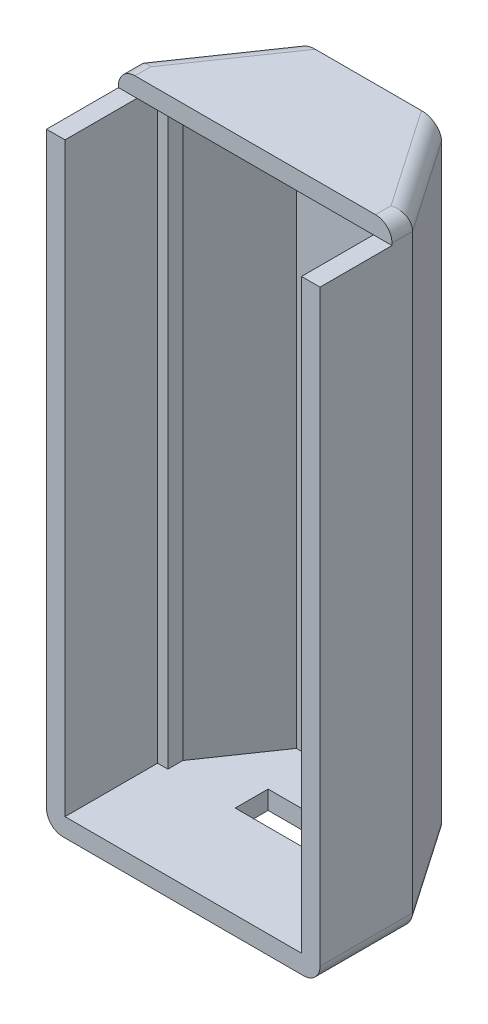
from build123d import *

# Parameters (mm, degrees)
BOSS_EXTRUDE1_DEPTH = 57
SKETCH4_W           = 6.5
SKETCH4_H           = 8.5
CUT_EXTRUDE1_DEPTH  = 62.236345417
BOSS_EXTRUDE2_DEPTH = 1.8
SKETCH5_W           = 7.9
SKETCH5_H           = 3.2
CUT_EXTRUDE2_DEPTH  = 63.91526047
BOSS_EXTRUDE3_DEPTH = 1.8
FILLET1_R           = 1.6


with BuildPart() as part:
    # Sketch1 → Boss-Extrude1 (new body)
    with BuildSketch(Plane(origin=(0, 0, 0), x_dir=(1, 0, 0), z_dir=(0, 1, 0))):
        Polygon((11.5, 0), (11.5, 9), (10.5, 9), (10.5, 10.454545455), (6, 17), (-6, 17), (-10.5, 10.454545455), (-10.5, 9), (-11.5, 9), (-11.5, 0), (-13.3, 0), (-13.3, 9), (-7.331417468, 17.681574593), (-7.1125, 18), (7.1125, 18), (7.368594903, 17.627498323), (13.3, 9), (13.3, 0), align=None)
    extrude(amount=BOSS_EXTRUDE1_DEPTH)

    # Sketch4 → Cut-Extrude1 (cut, through all)
    with BuildSketch(Plane(origin=(0, 0, -18), x_dir=(-1, 0, 0), z_dir=(0, 0, -1))):
        with Locations((-2.45, 12.45)):
            Rectangle(SKETCH4_W, SKETCH4_H)
    extrude(amount=-CUT_EXTRUDE1_DEPTH, mode=Mode.SUBTRACT)

    # Sketch2 → Boss-Extrude2 (add)
    with BuildSketch(Plane.XZ):
        Polygon((-13.3, 0), (-13.3, -9), (-7.1125, -18), (7.1125, -18), (13.3, -9), (13.3, 0), align=None)
    extrude(amount=BOSS_EXTRUDE2_DEPTH)

    # Sketch5 → Cut-Extrude2 (cut, through all)
    with BuildSketch(Plane.XZ.offset(1.8)):
        with Locations((0, -10.6)):
            Rectangle(SKETCH5_W, SKETCH5_H)
    extrude(amount=-CUT_EXTRUDE2_DEPTH, mode=Mode.SUBTRACT)

    # Sketch3 → Boss-Extrude3 (add)
    with BuildSketch(Plane(origin=(0, 57, 0), x_dir=(1, 0, 0), z_dir=(0, 1, 0))):
        Polygon((-13.3, 9), (-7.1125, 18), (7.1125, 18), (13.3, 9), (13.3, 7), (-13.3, 7), align=None)
    extrude(amount=BOSS_EXTRUDE3_DEPTH)

    # Fillet1
    fillet1_edges = [part.edges().sort_by_distance(p)[0] for p in [
        (-13.3, 58.8, -8),
        (13.3, 58.8, -8),
        (10.20625, 58.8, -13.5),
        (-10.20625, 58.8, -13.5),
        (-13.3, -1.8, -4.5),
        (-10.20625, -1.8, -13.5),
        (10.20625, -1.8, -13.5),
        (13.3, -1.8, -4.5),
    ]]
    fillet(fillet1_edges, radius=FILLET1_R)


solid = part.part
